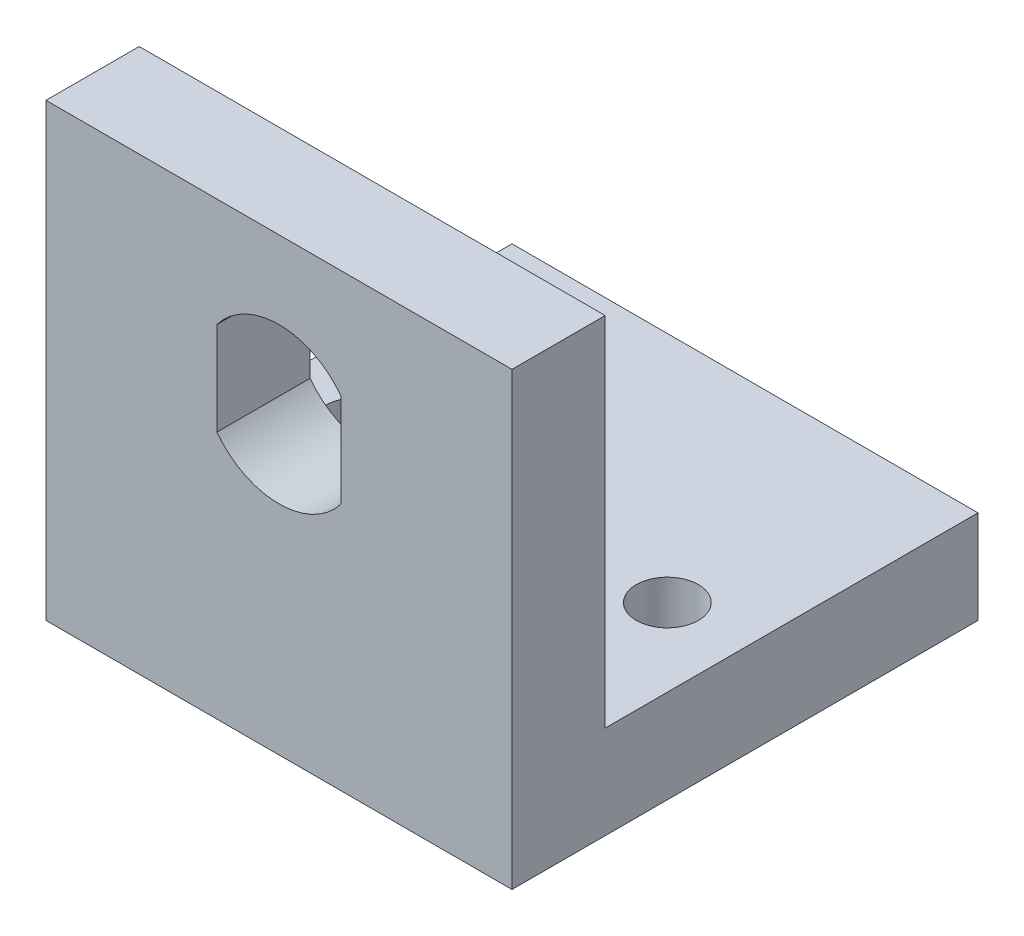
from build123d import *

# Parameters (mm, degrees)
EXTRUDE_1_DEPTH     = 15
SKETCH_2_R          = 2
CUT_EXTRUDE_1_DEPTH = 40
CUT_EXTRUDE_2_DEPTH = 40


with BuildPart() as part:
    # 草图1 → 凸台-拉伸1 (new, symmetric)
    with BuildSketch(Plane(origin=(0, 0, 0), x_dir=(0, 0, -1), z_dir=(1, 0, 0))):
        Polygon((0, 0), (0, 29), (6, 29), (6, 6), (30, 6), (30, 0), align=None)
    extrude(amount=EXTRUDE_1_DEPTH, both=True)

    # 草图2 → 切除-拉伸1 (cut)
    with BuildSketch(Plane(origin=(0, 0, 0), x_dir=(1, 0, 0), z_dir=(0, 1, 0))):
        with Locations(Location((-10, 15, 0), (0, 0, 90))):
            Circle(SKETCH_2_R)
        with Locations(Location((10, 15, 0), (0, 0, 90))):
            Circle(SKETCH_2_R)
    extrude(amount=CUT_EXTRUDE_1_DEPTH, mode=Mode.SUBTRACT)

    # 草图3 → 切除-拉伸2 (cut)
    with BuildSketch(Plane.XY):
        with BuildLine():
            Line((-4, 22), (-4, 16))
            ThreePointArc((-4, 16), (0, 14), (4, 16))
            Line((4, 16), (4, 22))
            ThreePointArc((4, 22), (0, 24), (-4, 22))
        make_face()
    extrude(amount=-CUT_EXTRUDE_2_DEPTH, mode=Mode.SUBTRACT)


solid = part.part
